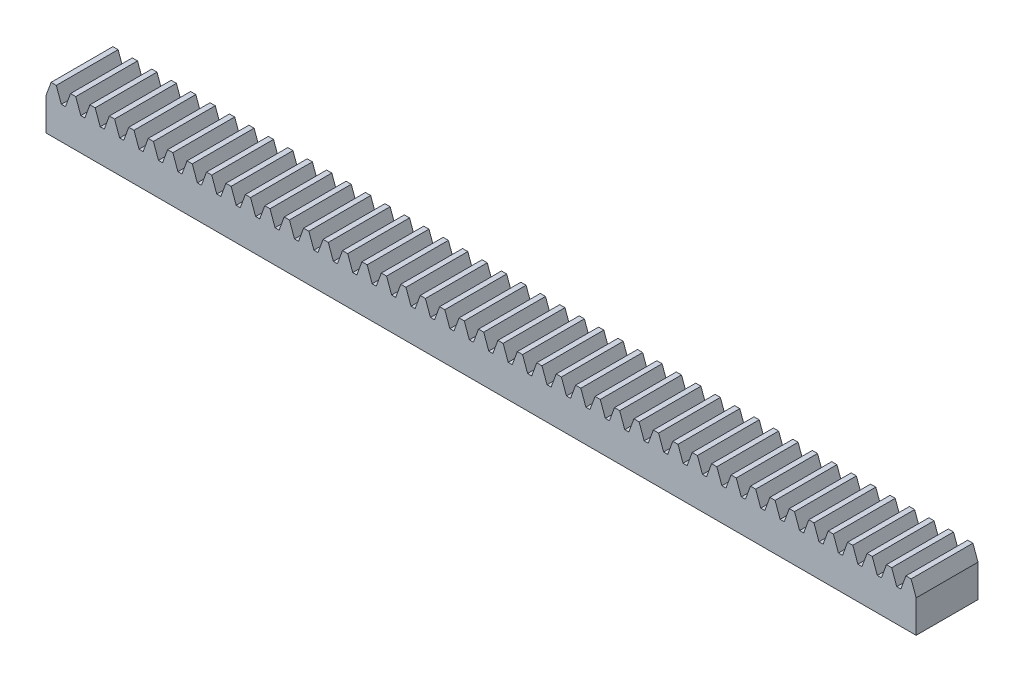
from build123d import *

# Parameters (mm, degrees)
SKETCH_2_W             = 281.42159734
SKETCH_2_H             = 20
EXTRUDE_1_DEPTH        = 10.5
EXTRUDE_2_DEPTH        = 10
PATTERN_LINEAR_1_COUNT = 45
PATTERN_LINEAR_1_PITCH = 6.283185307


with BuildPart() as part:
    # 草图2 → 凸台-拉伸1 (new body)
    with BuildSketch(Plane(origin=(0, 0, 0), x_dir=(1, 0, 0), z_dir=(0, 1, 0))):
        Rectangle(SKETCH_2_W, SKETCH_2_H)
    extrude(amount=-EXTRUDE_1_DEPTH)

    # 草图3 → 凸台-拉伸2 (add, symmetric)
    with BuildSketch(Plane.XY):
        Polygon((-140.71079867, 0), (-139.072932616, 4.5), (-137.3872209, 4.5), (-135.749354845, 0), align=None)
    extrude_2 = extrude(amount=EXTRUDE_2_DEPTH, both=True)

    # 阵列(线性)1: 凸台-拉伸2 ×45
    with Locations(*[(i * PATTERN_LINEAR_1_PITCH, 0, 0) for i in range(1, PATTERN_LINEAR_1_COUNT)]):
        add(extrude_2)


solid = part.part
